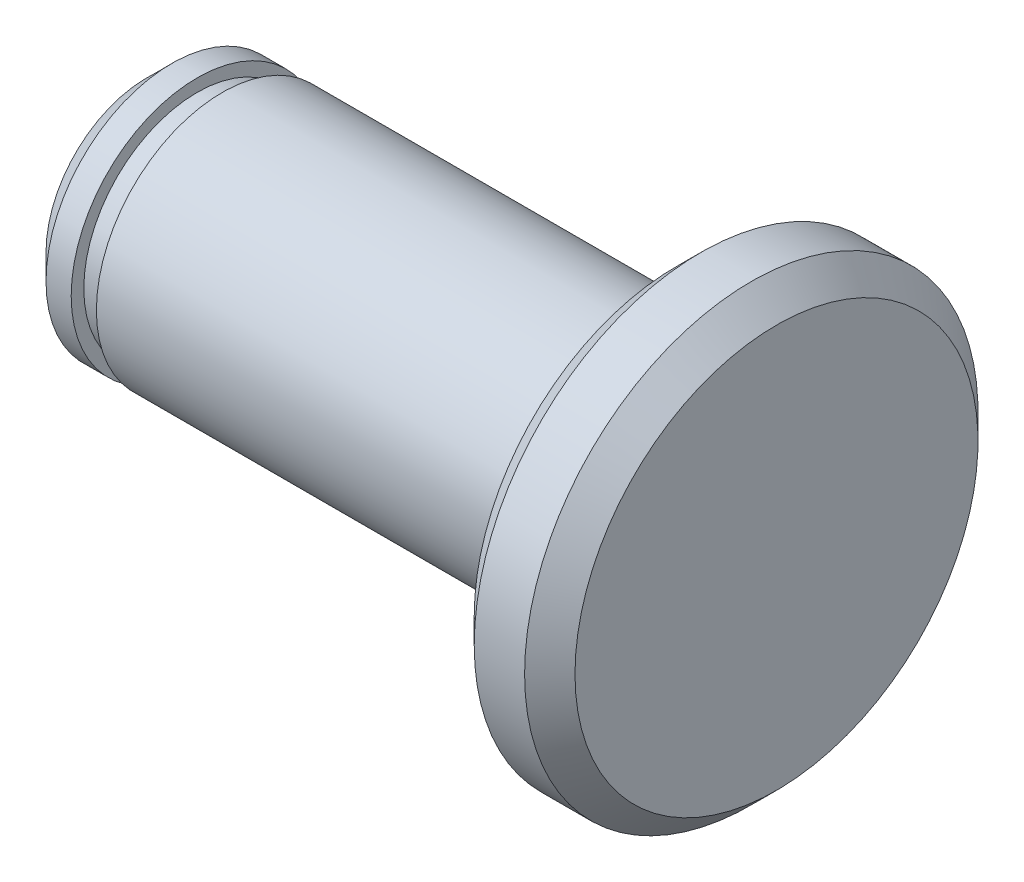
from build123d import *


with BuildPart() as part:
    # Sketch1 → Revolve1 (revolve)
    with BuildSketch(Plane(origin=(0, 0, 0), x_dir=(-1, 0, 0), z_dir=(0, 1, 0))):
        Polygon((-1, 9), (-3, 9), (-4, 8), (-4, 0), (21, 0), (21, 4), (20, 5), (19, 5), (19, 4.5), (18, 4.5), (18, 5), (0, 5), (0, 8), align=None)
    revolve(axis=Axis((-21, 0, 0), (1, 0, 0)))


solid = part.part
